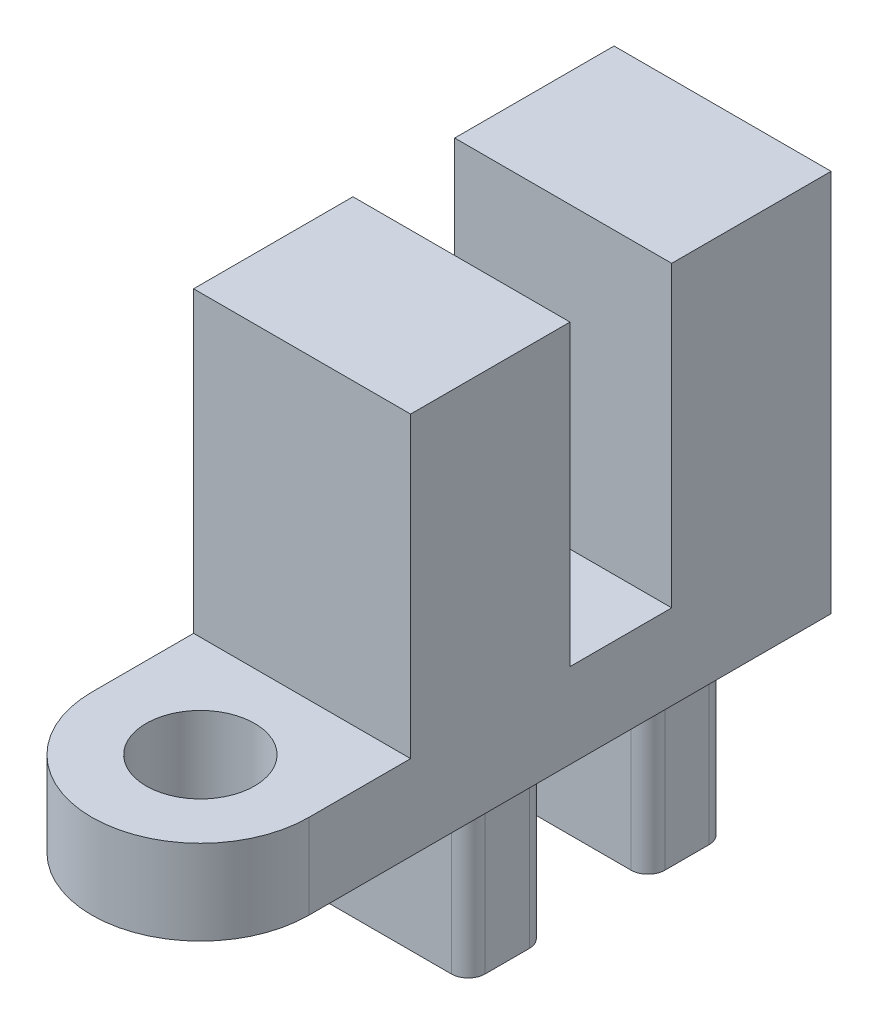
from build123d import *

# Parameters (mm, degrees)
ESQUISSE1_R      = 1.6
EXTRUSION1_DEPTH = 2.5
ESQUISSE2_W      = 6.4
ESQUISSE2_H      = 4.7
EXTRUSION2_DEPTH = 8.8
EXTRUSION3_DEPTH = 4.8


with BuildPart() as part:
    # Esquisse1 → Extrusion1 (new body)
    with BuildSketch(Plane(origin=(0, 0, 0), x_dir=(1, 0, 0), z_dir=(0, 1, 0))):
        with BuildLine():
            Line((-3.2, 6.2), (3.2, 6.2))
            Line((3.2, 6.2), (3.2, -9.2))
            ThreePointArc((3.2, -9.2), (0, -12.4), (-3.2, -9.2))
            Line((-3.2, -9.2), (-3.2, 6.2))
        make_face()
        with Locations((0, -9.2)):
            Circle(ESQUISSE1_R, mode=Mode.SUBTRACT)
    extrude(amount=-EXTRUSION1_DEPTH)

    # Esquisse2 → Extrusion2 (add)
    with BuildSketch(Plane(origin=(0, 0, 0), x_dir=(-1, 0, 0), z_dir=(0, 1, 0))):
        with Locations((0, -3.85)):
            Rectangle(ESQUISSE2_W, ESQUISSE2_H)
        with Locations((0, 3.85)):
            Rectangle(ESQUISSE2_W, ESQUISSE2_H)
    extrude(amount=EXTRUSION2_DEPTH)

    # Esquisse3 → Extrusion3 (add)
    with BuildSketch(Plane.XZ.offset(2.5)):
        with BuildLine():
            Line((-2, 3.8), (2, 3.8))
            ThreePointArc((2, 3.8), (2.353553391, 3.653553391), (2.5, 3.3))
            Line((2.5, 3.3), (2.5, 2))
            ThreePointArc((2.5, 2), (2.353553391, 1.646446609), (2, 1.5))
            Line((2, 1.5), (-2, 1.5))
            ThreePointArc((-2, 1.5), (-2.353553391, 1.646446609), (-2.5, 2))
            Line((-2.5, 2), (-2.5, 3.3))
            ThreePointArc((-2.5, 3.3), (-2.353553391, 3.653553391), (-2, 3.8))
        make_face()
        with BuildLine():
            Line((-2, -1.5), (2, -1.5))
            ThreePointArc((2, -1.5), (2.353553391, -1.646446609), (2.5, -2))
            Line((2.5, -2), (2.5, -3.3))
            ThreePointArc((2.5, -3.3), (2.353553391, -3.653553391), (2, -3.8))
            Line((2, -3.8), (-2, -3.8))
            ThreePointArc((-2, -3.8), (-2.353553391, -3.653553391), (-2.5, -3.3))
            Line((-2.5, -3.3), (-2.5, -2))
            ThreePointArc((-2.5, -2), (-2.353553391, -1.646446609), (-2, -1.5))
        make_face()
    extrude(amount=EXTRUSION3_DEPTH)


solid = part.part
